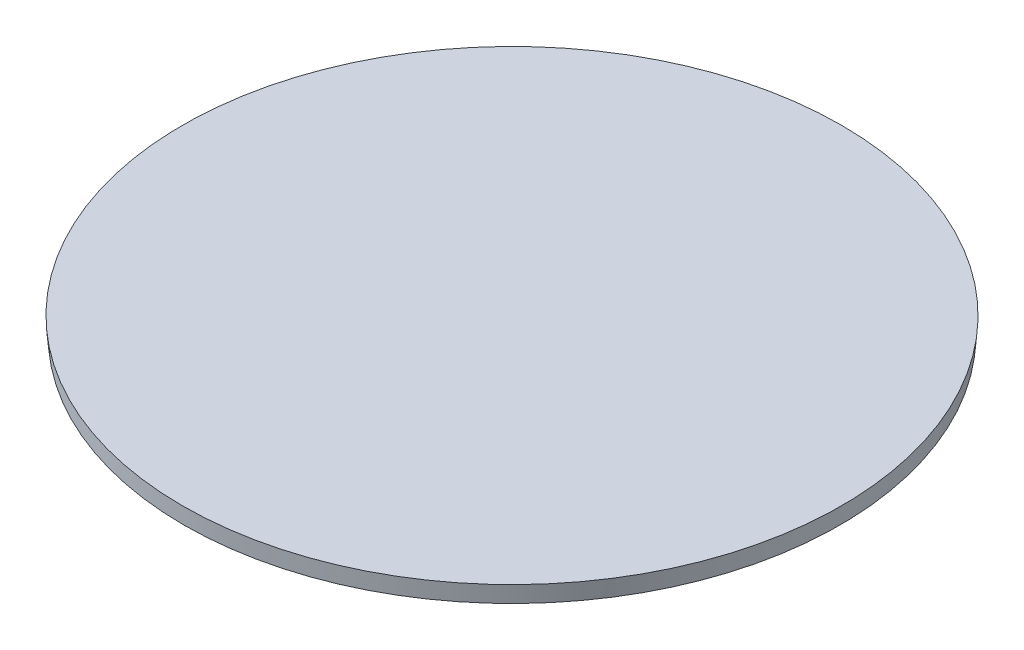
from build123d import *

# Parameters (mm, degrees)
SKETCH1_R      = 18.85
EXTRUDE1_DEPTH = 1
EXTRUDE1_DRAFT = -5


with BuildPart() as part:
    # Sketch1 → Extrude1 (with draft: the straight prism first)
    with BuildSketch(Plane(origin=(0, 0, 0), x_dir=(1, 0, 0), z_dir=(0, 1, 0))):
        Circle(SKETCH1_R)
    extrude(amount=-EXTRUDE1_DEPTH)
    # Extrude1: the draft: its side faces are tilted about the plane it starts from
    extrude1_sides = [part.faces().sort_by_distance(p)[0] for p in [
        (-18.85, -0.5, 0),
    ]]
    draft(extrude1_sides, Plane(origin=(0, 0, 0), x_dir=(1, 0, 0), z_dir=(0, 1, 0)), EXTRUDE1_DRAFT)


solid = part.part
